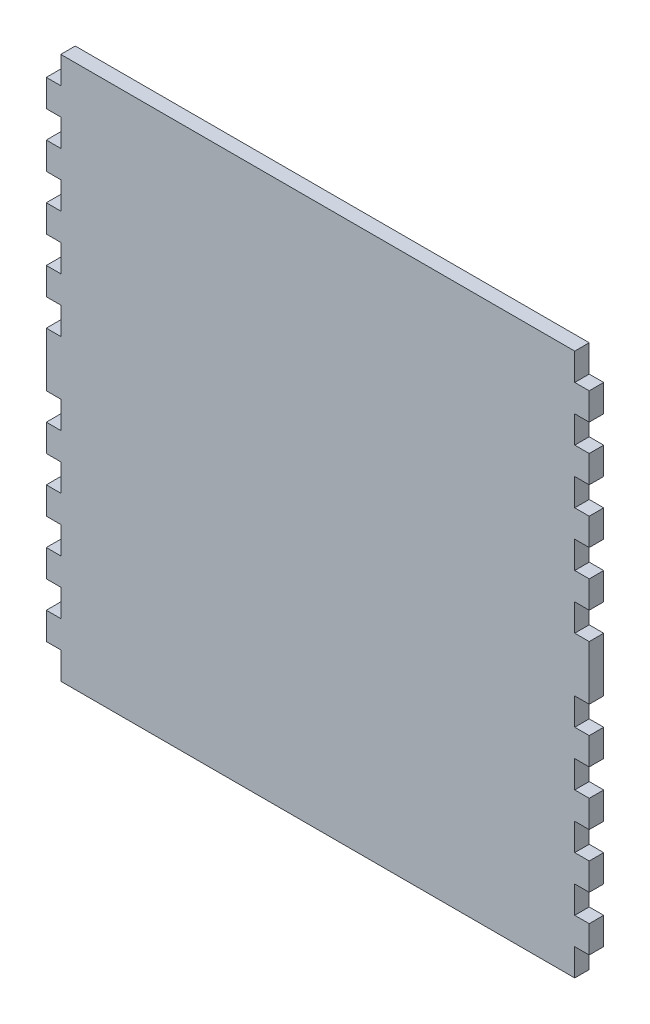
from build123d import *

# Parameters (mm, degrees)
ESQUISSE1_W             = 300
ESQUISSE1_H             = 300
BOSS_EXTRU_1_DEPTH      = 8
ESQUISSE3_W             = 8
ESQUISSE3_H             = 15
ENL_V_MAT_EXTRU_4_DEPTH = 213.282830205


with BuildPart() as part:
    # Esquisse1 → Boss.-Extru.1 (new body)
    with BuildSketch(Plane.XY):
        Rectangle(ESQUISSE1_W, ESQUISSE1_H)
    extrude(amount=BOSS_EXTRU_1_DEPTH)

    # Esquisse3 → Enlèv. mat.-Extru.4 (cut, through all)
    with BuildSketch(Plane.XY):
        with Locations((-146, -22.5)):
            Rectangle(ESQUISSE3_W, ESQUISSE3_H)
        with Locations((-146, -52.5)):
            Rectangle(ESQUISSE3_W, ESQUISSE3_H)
        with Locations((-146, -82.5)):
            Rectangle(ESQUISSE3_W, ESQUISSE3_H)
        with Locations((-146, -112.5)):
            Rectangle(ESQUISSE3_W, ESQUISSE3_H)
        with Locations((-146, -142.5)):
            Rectangle(ESQUISSE3_W, ESQUISSE3_H)
        with Locations((-146, 52.5)):
            Rectangle(ESQUISSE3_W, ESQUISSE3_H)
        with Locations((-146, 142.5)):
            Rectangle(ESQUISSE3_W, ESQUISSE3_H)
        with Locations((-146, 112.5)):
            Rectangle(ESQUISSE3_W, ESQUISSE3_H)
        with Locations((-146, 82.5)):
            Rectangle(ESQUISSE3_W, ESQUISSE3_H)
        with Locations((-146, 22.5)):
            Rectangle(ESQUISSE3_W, ESQUISSE3_H)
    enl_v_mat_extru_4 = extrude(amount=ENL_V_MAT_EXTRU_4_DEPTH, mode=Mode.SUBTRACT)

    # Symétrie1: Enlèv. mat.-Extru.4 across plane
    add(enl_v_mat_extru_4.mirror(Plane(origin=(0, 0, 0), x_dir=(0, 0, 1), z_dir=(1, 0, 0))), mode=Mode.SUBTRACT)


solid = part.part
